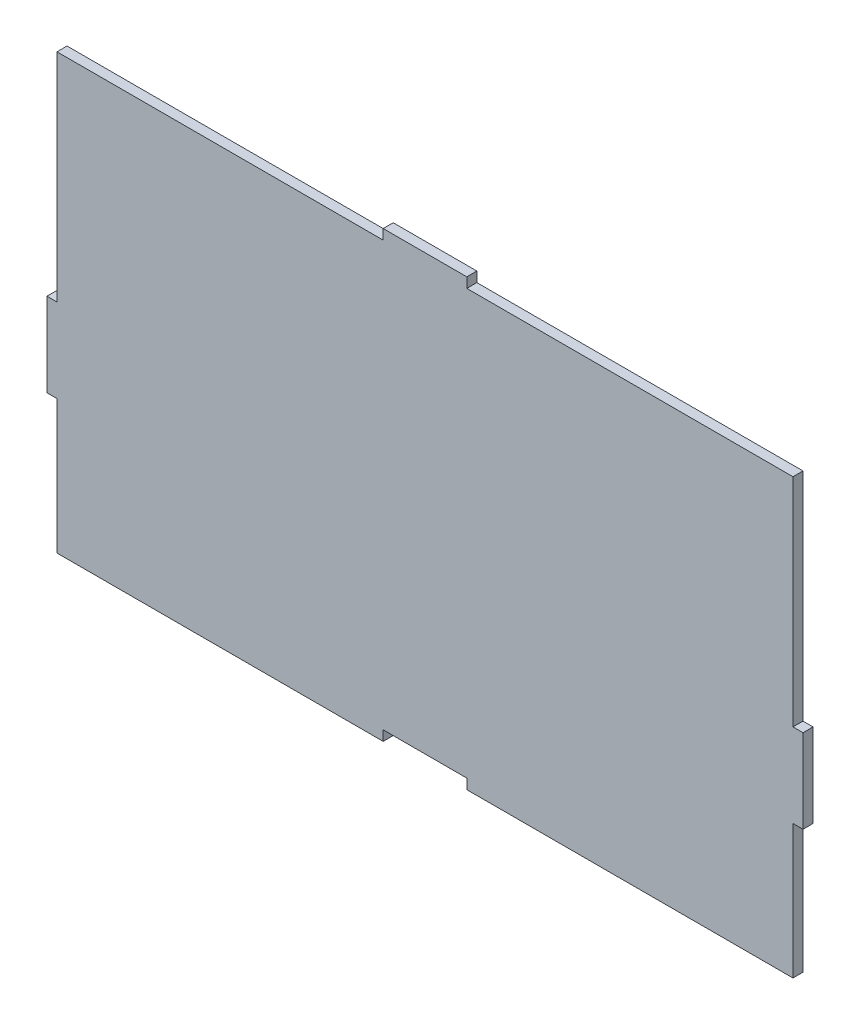
from build123d import *

# Parameters (mm, degrees)
EXTRUDE_1_DEPTH = 3


with BuildPart() as part:
    # Эскиз1 → Бобышка-Вытянуть1 (new body)
    with BuildSketch(Plane.XY):
        Polygon((-115.213739234, -31.042785566), (-115.213739234, -71.042785566), (-17.713739234, -71.042785566), (-17.713739234, -68.042785566), (7.286260766, -68.042785566), (7.286260766, -71.042785566), (104.786260766, -71.042785566), (104.786260766, -31.042785566), (107.786260766, -31.042785566), (107.786260766, -6.042785566), (104.786260766, -6.042785566), (104.786260766, 58.727214434), (7.286260766, 58.727214434), (7.286260766, 61.727214434), (-17.713739234, 61.727214434), (-17.713739234, 58.727214434), (-115.213739234, 58.727214434), (-115.213739234, -6.042785566), (-118.213739234, -6.042785566), (-118.213739234, -31.042785566), align=None)
    extrude(amount=EXTRUDE_1_DEPTH)


solid = part.part
